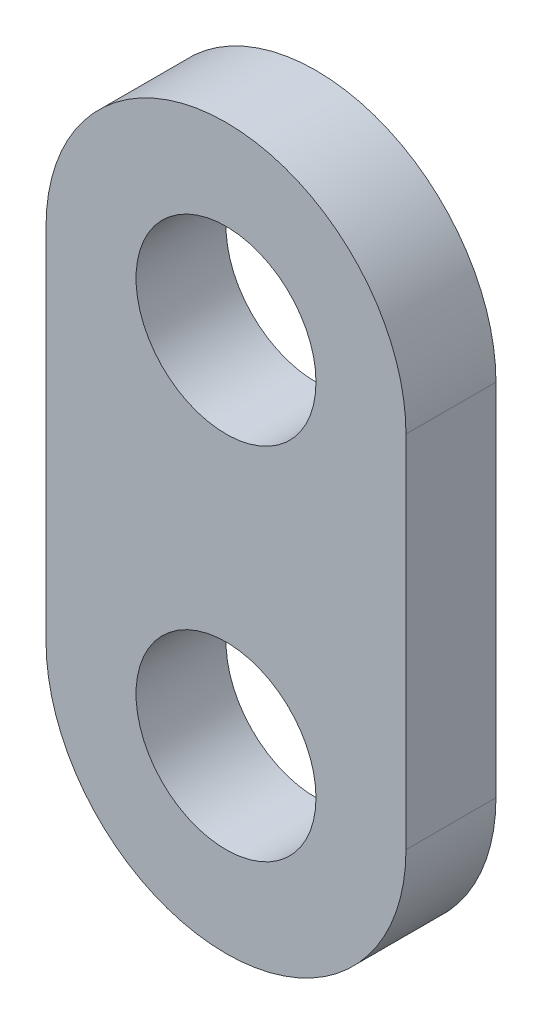
from build123d import *

# Parameters (mm, degrees)
SKETCH1_R           = 25
BOSS_EXTRUDE1_DEPTH = 25


with BuildPart() as part:
    # Sketch1 → Boss-Extrude1 (new body)
    with BuildSketch(Plane.XY):
        with BuildLine():
            Line((-50, 50), (-50, -50))
            ThreePointArc((-50, -50), (0, -100), (50, -50))
            Line((50, -50), (50, 50))
            ThreePointArc((50, 50), (0, 100), (-50, 50))
        make_face()
        with Locations((0, 50)):
            Circle(SKETCH1_R, mode=Mode.SUBTRACT)
        with Locations((0, -50)):
            Circle(SKETCH1_R, mode=Mode.SUBTRACT)
    extrude(amount=BOSS_EXTRUDE1_DEPTH)


solid = part.part
